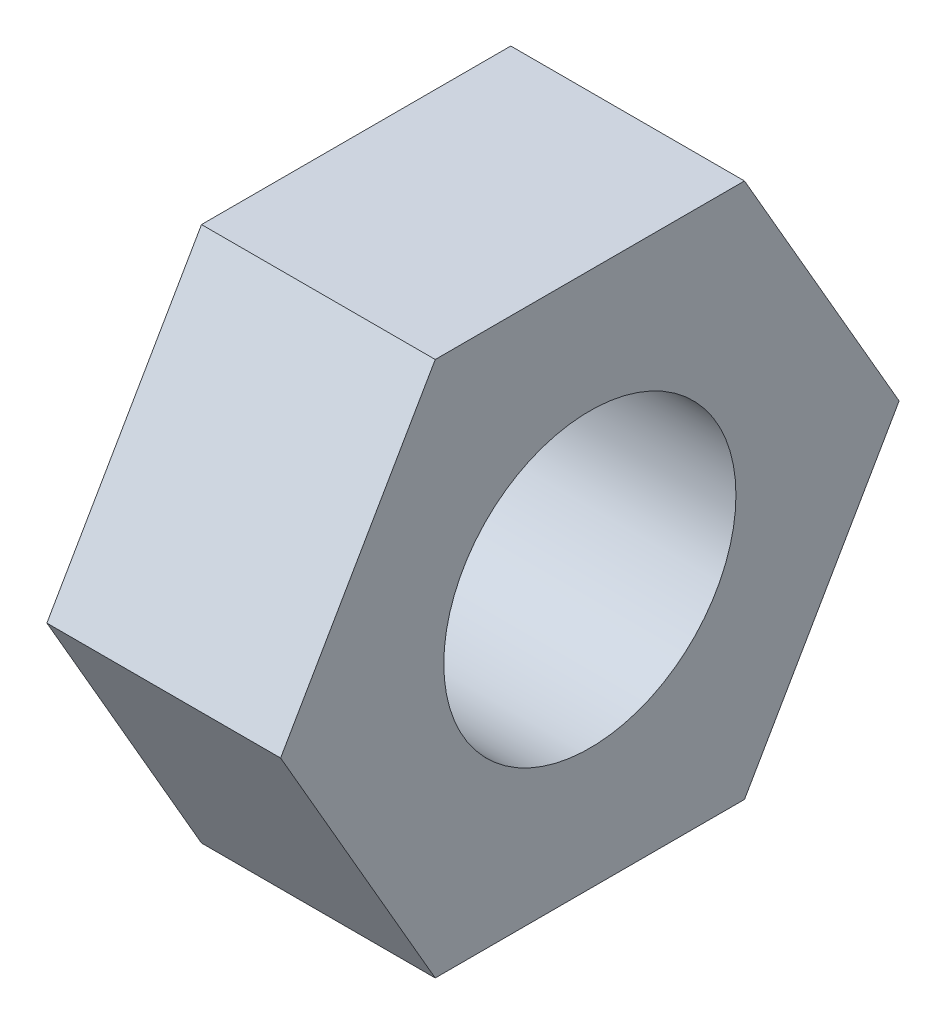
from build123d import *

# Parameters (mm, degrees)
SKETCH1_R           = 1.5
BOSS_EXTRUDE1_DEPTH = 2.4


with BuildPart() as part:
    # Sketch1 → Boss-Extrude1 (new body)
    with BuildSketch(Plane(origin=(0, 0, 0), x_dir=(0, 0, -1), z_dir=(1, 0, 0))):
        Polygon((3.175426481, 0), (1.58771324, 2.75), (-1.58771324, 2.75), (-3.175426481, 0), (-1.58771324, -2.75), (1.58771324, -2.75), align=None)
        Circle(SKETCH1_R, mode=Mode.SUBTRACT)
    extrude(amount=BOSS_EXTRUDE1_DEPTH)


solid = part.part
